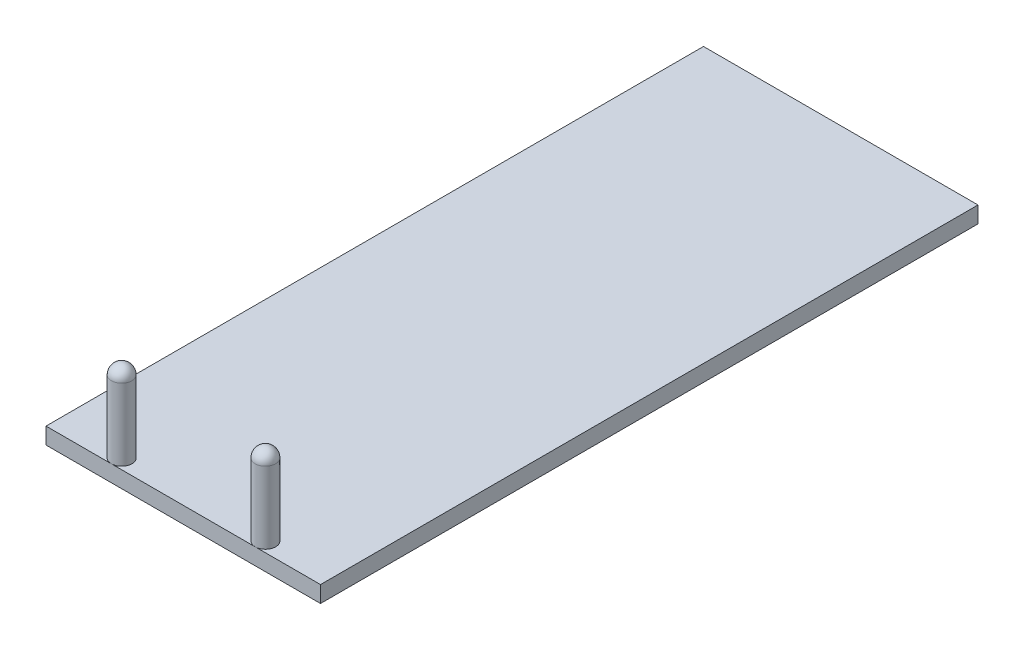
from build123d import *

# Parameters (mm, degrees)
SKETCH_1_W      = 334
SKETCH_1_H      = 800
EXTRUDE_1_DEPTH = 20
SKETCH_3_R      = 12.5
EXTRUDE_4_DEPTH = 100
FILLET_1_R      = 12.5


with BuildPart() as part:
    # Эскиз1 → Бобышка-Вытянуть1 (new body)
    with BuildSketch(Plane(origin=(0, 0, 0), x_dir=(1, 0, 0), z_dir=(0, 1, 0))):
        Rectangle(SKETCH_1_W, SKETCH_1_H)
    extrude(amount=-EXTRUDE_1_DEPTH)

    # Эскиз3 → Бобышка-Вытянуть4 (add)
    with BuildSketch(Plane(origin=(0, 0, 0), x_dir=(1, 0, 0), z_dir=(0, 1, 0))):
        with Locations(Location((-87.470406544, -387.5, 0), (0, 0, 270))):
            Circle(SKETCH_3_R)
        with Locations(Location((87.470406544, -387.5, 0), (0, 0, 270))):
            Circle(SKETCH_3_R)
    extrude(amount=EXTRUDE_4_DEPTH)

    # Скругление1
    fillet_1_edges = [part.edges().sort_by_distance(p)[0] for p in [
        (-87.470406544, 100, 375),
        (87.470406544, 100, 375),
    ]]
    fillet(fillet_1_edges, radius=FILLET_1_R)


solid = part.part
